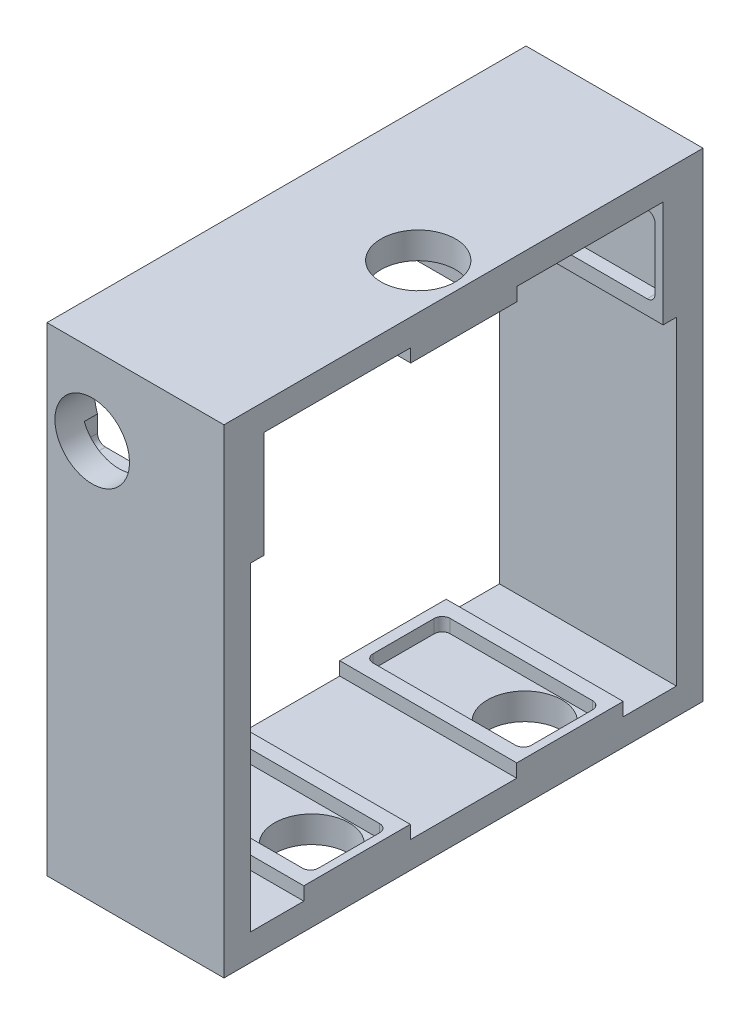
from build123d import *

# Parameters (mm, degrees)
SKETCH1_W           = 66.5
SKETCH1_H           = 180
BOSS_EXTRUDE1_DEPTH = 180
SKETCH3_W           = 160
SKETCH3_H           = 160
CUT_EXTRUDE1_DEPTH  = 180
SKETCH8_W           = 66.5
SKETCH8_H           = 40
BOSS_EXTRUDE2_DEPTH = 5
SKETCH10_W          = 66.5
SKETCH10_H          = 40
BOSS_EXTRUDE3_DEPTH = 5
SKETCH5_R           = 14
CUT_EXTRUDE3_DEPTH  = 10
SKETCH7_R           = 14
CUT_EXTRUDE4_DEPTH  = 10
CUT_EXTRUDE5_DEPTH  = 5
CUT_EXTRUDE6_START  = -5
CUT_EXTRUDE6_DEPTH  = 5
SKETCH12_W          = 66.5
SKETCH12_H          = 40
BOSS_EXTRUDE8_DEPTH = 5
SKETCH15_R          = 14
CUT_EXTRUDE7_DEPTH  = 200
SKETCH16_W          = 66.5
SKETCH16_H          = 40
BOSS_EXTRUDE9_DEPTH = 5


with BuildPart() as part:
    # Sketch1 → Boss-Extrude1 (new body)
    with BuildSketch(Plane.XY):
        with Locations((33.25, 90)):
            Rectangle(SKETCH1_W, SKETCH1_H)
    extrude(amount=BOSS_EXTRUDE1_DEPTH)

    # Sketch3 → Cut-Extrude1 (cut)
    with BuildSketch(Plane.ZY):
        with Locations((90, 90)):
            Rectangle(SKETCH3_W, SKETCH3_H)
    extrude(amount=-CUT_EXTRUDE1_DEPTH, mode=Mode.SUBTRACT)

    # Sketch8 → Boss-Extrude2 (add)
    with BuildSketch(Plane.XY.offset(10)):
        with Locations((33.25, 150)):
            Rectangle(SKETCH8_W, SKETCH8_H)
    extrude(amount=BOSS_EXTRUDE2_DEPTH)

    # Sketch10 → Boss-Extrude3 (add)
    with BuildSketch(Plane(origin=(0, 0, 170), x_dir=(-1, 0, 0), z_dir=(0, 0, -1))):
        with Locations((-33.25, 150)):
            Rectangle(SKETCH10_W, SKETCH10_H)
    extrude(amount=BOSS_EXTRUDE3_DEPTH)

    # Sketch5 → Cut-Extrude3 (cut)
    with BuildSketch(Plane(origin=(0, 180, 0), x_dir=(1, 0, 0), z_dir=(0, 1, 0))):
        with Locations(Location((49.5, -90, 0), (0, 0, 270))):
            Circle(SKETCH5_R)
    extrude(amount=-CUT_EXTRUDE3_DEPTH, mode=Mode.SUBTRACT)

    # Sketch7 → Cut-Extrude4 (cut)
    with BuildSketch(Plane.XZ):
        with Locations(Location((49.5, 50, 0), (0, 0, 270))):
            Circle(SKETCH7_R)
        with Locations(Location((49.5, 130, 0), (0, 0, 270))):
            Circle(SKETCH7_R)
    extrude(amount=-CUT_EXTRUDE4_DEPTH, mode=Mode.SUBTRACT)

    # Sketch9 → Cut-Extrude5 (cut)
    with BuildSketch(Plane.XY.offset(15)):
        with BuildLine():
            Line((60.5, 164.5), (7.5, 164.5))
            ThreePointArc((7.5, 164.5), (5.378679656, 163.621320344), (4.5, 161.5))
            Line((4.5, 161.5), (4.5, 138.5))
            ThreePointArc((4.5, 138.5), (5.378679656, 136.378679656), (7.5, 135.5))
            Line((7.5, 135.5), (60.5, 135.5))
            ThreePointArc((60.5, 135.5), (62.621320344, 136.378679656), (63.5, 138.5))
            Line((63.5, 138.5), (63.5, 161.5))
            ThreePointArc((63.5, 161.5), (62.621320344, 163.621320344), (60.5, 164.5))
        make_face()
    extrude(amount=-CUT_EXTRUDE5_DEPTH, mode=Mode.SUBTRACT)

    # Sketch11 → Cut-Extrude6 (cut)
    with BuildSketch(Plane(origin=(0, 0, 165), x_dir=(-1, 0, 0), z_dir=(0, 0, -1)).offset(CUT_EXTRUDE6_START)):
        with BuildLine():
            Line((-60.5, 164.5), (-7, 164.5))
            ThreePointArc((-7, 164.5), (-4.878679656, 163.621320344), (-4, 161.5))
            Line((-4, 161.5), (-4, 138.5))
            ThreePointArc((-4, 138.5), (-4.878679656, 136.378679656), (-7, 135.5))
            Line((-7, 135.5), (-60.5, 135.5))
            ThreePointArc((-60.5, 135.5), (-62.621320344, 136.378679656), (-63.5, 138.5))
            Line((-63.5, 138.5), (-63.5, 161.5))
            ThreePointArc((-63.5, 161.5), (-62.621320344, 163.621320344), (-60.5, 164.5))
        make_face()
    extrude(amount=CUT_EXTRUDE6_DEPTH, mode=Mode.SUBTRACT)

    # Sketch12 → Boss-Extrude8 (add)
    with BuildSketch(Plane.XZ.offset(-170)):
        with Locations((33.25, 89.833476808)):
            Rectangle(SKETCH12_W, SKETCH12_H)
        with BuildLine():
            Line((60.5, 75.333476808), (7, 75.333476808))
            ThreePointArc((7, 75.333476808), (4.878679656, 76.212156465), (4, 78.333476808))
            Line((4, 78.333476808), (4, 101.333476808))
            ThreePointArc((4, 101.333476808), (4.878679656, 103.454797152), (7, 104.333476808))
            Line((7, 104.333476808), (60.5, 104.333476808))
            ThreePointArc((60.5, 104.333476808), (62.621320344, 103.454797152), (63.5, 101.333476808))
            Line((63.5, 101.333476808), (63.5, 78.333476808))
            ThreePointArc((63.5, 78.333476808), (62.621320344, 76.212156465), (60.5, 75.333476808))
        make_face(mode=Mode.SUBTRACT)
    extrude(amount=BOSS_EXTRUDE8_DEPTH)

    # Sketch15 → Cut-Extrude7 (cut)
    with BuildSketch(Plane(origin=(0, 0, 0), x_dir=(-1, 0, 0), z_dir=(0, 0, -1))):
        with Locations((-17, 150)):
            Circle(SKETCH15_R)
    extrude(amount=-CUT_EXTRUDE7_DEPTH, mode=Mode.SUBTRACT)

    # Sketch16 → Boss-Extrude9 (add)
    # profile 1 of 2: a face of its own
    with BuildSketch(Plane(origin=(0, 10, 0), x_dir=(1, 0, 0), z_dir=(0, 1, 0))):
        with Locations((33.25, -50)):
            Rectangle(SKETCH16_W, SKETCH16_H)
        with BuildLine():
            Line((63.5, -38.5), (63.5, -61.5))
            ThreePointArc((63.5, -61.5), (62.621320344, -63.621320344), (60.5, -64.5))
            Line((60.5, -64.5), (7, -64.5))
            ThreePointArc((7, -64.5), (4.878679656, -63.621320344), (4, -61.5))
            Line((4, -61.5), (4, -38.5))
            ThreePointArc((4, -38.5), (4.878679656, -36.378679656), (7, -35.5))
            Line((7, -35.5), (60.5, -35.5))
            ThreePointArc((60.5, -35.5), (62.621320344, -36.378679656), (63.5, -38.5))
        make_face(mode=Mode.SUBTRACT)
    # profile 2 of 2: a face of its own
    with BuildSketch(Plane(origin=(0, 10, 0), x_dir=(1, 0, 0), z_dir=(0, 1, 0))):
        with Locations((33.25, -130)):
            Rectangle(SKETCH16_W, SKETCH16_H)
        with BuildLine():
            Line((63.5, -141.5), (63.5, -118.5))
            ThreePointArc((63.5, -118.5), (62.621320344, -116.378679656), (60.5, -115.5))
            Line((60.5, -115.5), (7, -115.5))
            ThreePointArc((7, -115.5), (4.878679656, -116.378679656), (4, -118.5))
            Line((4, -118.5), (4, -141.5))
            ThreePointArc((4, -141.5), (4.878679656, -143.621320344), (7, -144.5))
            Line((7, -144.5), (60.5, -144.5))
            ThreePointArc((60.5, -144.5), (62.621320344, -143.621320344), (63.5, -141.5))
        make_face(mode=Mode.SUBTRACT)
    extrude(amount=BOSS_EXTRUDE9_DEPTH)


solid = part.part
